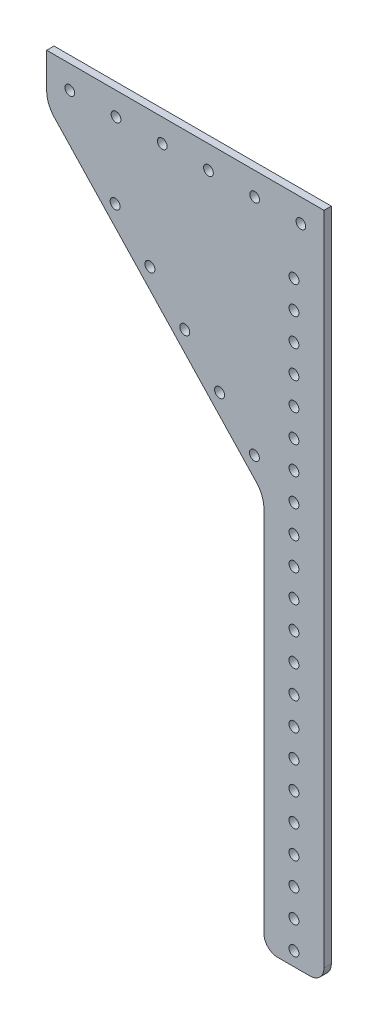
from build123d import *

# Parameters (mm, degrees)
SKETCH1_R           = 2.15
SKETCH1_R_2         = 2.1
BOSS_EXTRUDE1_DEPTH = 3.175
FILLET2_R           = 12
FILLET3_R           = 6


with BuildPart() as part:
    # Sketch1 → Boss-Extrude1 (new body)
    with BuildSketch(Plane.XY):
        Polygon((26, 290), (26, 0), (0, 0), (0, 170), (-94, 270), (-94, 290), align=None)
        with Locations((13, 6)):
            Circle(SKETCH1_R, mode=Mode.SUBTRACT)
        with Locations((13, 18)):
            Circle(SKETCH1_R, mode=Mode.SUBTRACT)
        with Locations((13, 30)):
            Circle(SKETCH1_R, mode=Mode.SUBTRACT)
        with Locations((13, 42)):
            Circle(SKETCH1_R, mode=Mode.SUBTRACT)
        with Locations((13, 54)):
            Circle(SKETCH1_R, mode=Mode.SUBTRACT)
        with Locations((13, 66)):
            Circle(SKETCH1_R, mode=Mode.SUBTRACT)
        with Locations((13, 78)):
            Circle(SKETCH1_R, mode=Mode.SUBTRACT)
        with Locations((13, 90)):
            Circle(SKETCH1_R, mode=Mode.SUBTRACT)
        with Locations((13, 102)):
            Circle(SKETCH1_R, mode=Mode.SUBTRACT)
        with Locations((13, 114)):
            Circle(SKETCH1_R, mode=Mode.SUBTRACT)
        with Locations((13, 126)):
            Circle(SKETCH1_R, mode=Mode.SUBTRACT)
        with Locations((13, 138)):
            Circle(SKETCH1_R, mode=Mode.SUBTRACT)
        with Locations((13, 150)):
            Circle(SKETCH1_R, mode=Mode.SUBTRACT)
        with Locations((13, 162)):
            Circle(SKETCH1_R, mode=Mode.SUBTRACT)
        with Locations((13, 174)):
            Circle(SKETCH1_R, mode=Mode.SUBTRACT)
        with Locations((13, 186)):
            Circle(SKETCH1_R, mode=Mode.SUBTRACT)
        with Locations((13, 198)):
            Circle(SKETCH1_R, mode=Mode.SUBTRACT)
        with Locations((13, 210)):
            Circle(SKETCH1_R, mode=Mode.SUBTRACT)
        with Locations((16, 280)):
            Circle(SKETCH1_R_2, mode=Mode.SUBTRACT)
        with Locations((-4, 280)):
            Circle(SKETCH1_R_2, mode=Mode.SUBTRACT)
        with Locations((-24, 280)):
            Circle(SKETCH1_R_2, mode=Mode.SUBTRACT)
        with Locations((-44, 280)):
            Circle(SKETCH1_R_2, mode=Mode.SUBTRACT)
        with Locations((-64, 280)):
            Circle(SKETCH1_R_2, mode=Mode.SUBTRACT)
        with Locations((-4.109460053, 183.132040974)):
            Circle(SKETCH1_R, mode=Mode.SUBTRACT)
        with Locations((-19.177480246, 199.16184969)):
            Circle(SKETCH1_R, mode=Mode.SUBTRACT)
        with Locations((-34.245500438, 215.191658406)):
            Circle(SKETCH1_R, mode=Mode.SUBTRACT)
        with Locations((-49.313520631, 231.221467121)):
            Circle(SKETCH1_R, mode=Mode.SUBTRACT)
        with Locations((-64.381540824, 247.251275837)):
            Circle(SKETCH1_R, mode=Mode.SUBTRACT)
        with Locations((13, 222)):
            Circle(SKETCH1_R, mode=Mode.SUBTRACT)
        with Locations((13, 234)):
            Circle(SKETCH1_R, mode=Mode.SUBTRACT)
        with Locations((13, 246)):
            Circle(SKETCH1_R, mode=Mode.SUBTRACT)
        with Locations((13, 258)):
            Circle(SKETCH1_R, mode=Mode.SUBTRACT)
        with Locations((-84, 280)):
            Circle(SKETCH1_R_2, mode=Mode.SUBTRACT)
    extrude(amount=BOSS_EXTRUDE1_DEPTH)

    # Fillet2
    fillet2_edges = [part.edges().sort_by_distance(p)[0] for p in [
        (0, 170, 1.5875),
        (-94, 270, 1.5875),
    ]]
    fillet(fillet2_edges, radius=FILLET2_R)

    # Fillet3
    fillet3_edges = [part.edges().sort_by_distance(p)[0] for p in [
        (26, 0, 1.5875),
        (0, 0, 1.5875),
    ]]
    fillet(fillet3_edges, radius=FILLET3_R)


solid = part.part
